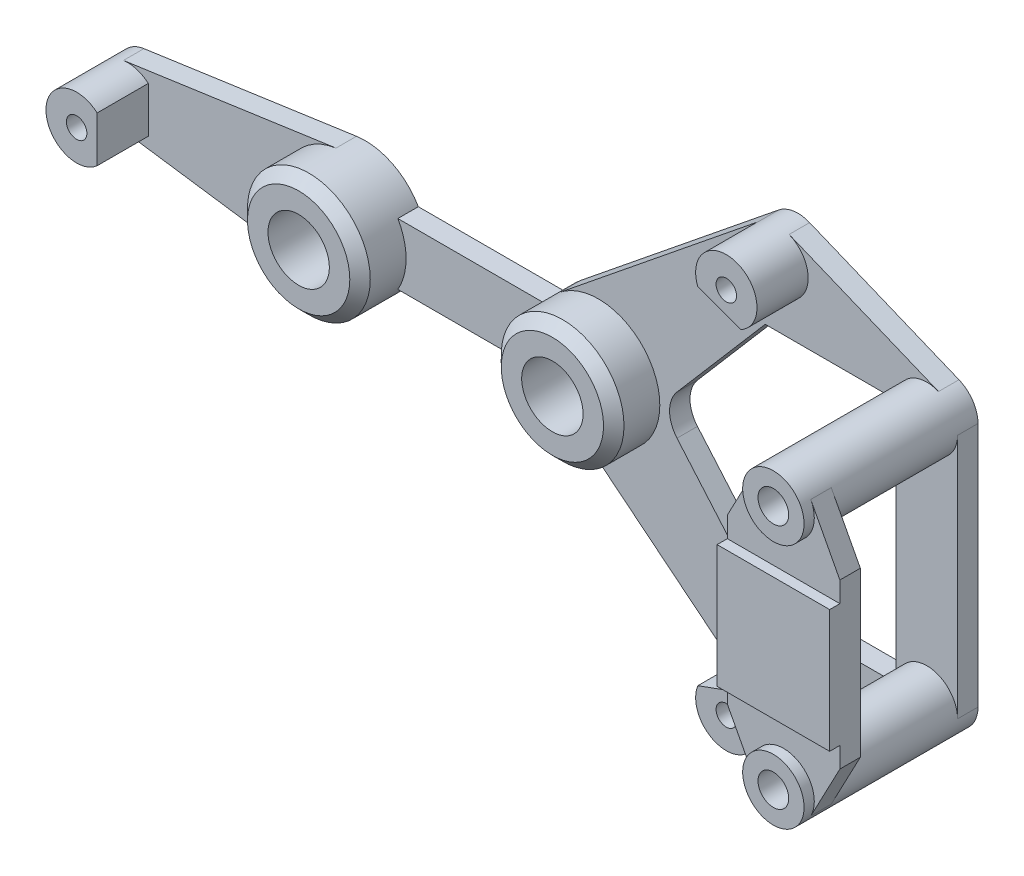
from build123d import *
from build123d.topology import SkipClean

# Parameters (mm, degrees)
BOSS_EXTRUDE1_DEPTH = 2
BOSS_EXTRUDE2_START = 4.5
SKETCH2_R           = 6
SKETCH2_R_2         = 3
BOSS_EXTRUDE2_DEPTH = 4.5
CHAMFER1_SIZE       = 1
BOSS_EXTRUDE3_START = 5
SKETCH3_R           = 1
BOSS_EXTRUDE3_DEPTH = 5
BOSS_EXTRUDE4_START = 15
SKETCH4_R           = 3
SKETCH4_R_2         = 1.5
BOSS_EXTRUDE4_DEPTH = 15
SKETCH5_R           = 1.5
BOSS_EXTRUDE5_DEPTH = 3
CUT_EXTRUDE1_DEPTH  = 1


with BuildPart() as part:
    # Sketch1 → Boss-Extrude1 (new body)
    with BuildSketch(Plane.XY):
        with BuildLine():
            Line((-5.196152423, 3), (-19.603847577, 3))
            ThreePointArc((-19.603847577, 3), (-22.176137566, 5.39586378), (-25.649056604, 5.939621443))
            Line((-25.649056604, 5.939621443), (-46.424528302, 2.969810721))
            ThreePointArc((-46.424528302, 2.969810721), (-49, 0), (-46.424528302, -2.969810721))
            Line((-46.424528302, -2.969810721), (-25.649056604, -5.939621443))
            ThreePointArc((-25.649056604, -5.939621443), (-22.176137566, -5.39586378), (-19.603847577, -3))
            Line((-19.603847577, -3), (-5.196152423, -3))
            ThreePointArc((-5.196152423, -3), (-4.560521825, -3.898928146), (-3.771341235, -4.666581756))
            Line((-3.771341235, -4.666581756), (15.614329382, -20.333290878))
            ThreePointArc((15.614329382, -20.333290878), (17.066851522, -20.968565714), (18.640337336, -20.774820852))
            Line((18.640337336, -20.774820852), (33.240337336, -14.774820852))
            ThreePointArc((33.240337336, -14.774820852), (34.592088683, -13.670177833), (35.1, -12))
            Line((35.1, -12), (35.1, 12))
            ThreePointArc((35.1, 12), (34.592088683, 13.670177833), (33.240337336, 14.774820852))
            Line((33.240337336, 14.774820852), (18.640337336, 20.774820852))
            ThreePointArc((18.640337336, 20.774820852), (17.066851522, 20.968565714), (15.614329382, 20.333290878))
            Line((15.614329382, 20.333290878), (-3.771341235, 4.666581756))
            ThreePointArc((-3.771341235, 4.666581756), (-4.560521825, 3.898928146), (-5.196152423, 3))
        make_face()
        with BuildLine():
            Line((7.677811186, 1.954226556), (16.302661255, 12))
            Line((16.302661255, 12), (29.1, 12))
            Line((29.1, 12), (29.1, -12))
            Line((29.1, -12), (16.302661255, -12))
            Line((16.302661255, -12), (7.677811186, -1.954226556))
            ThreePointArc((7.677811186, -1.954226556), (6.953991883, 0), (7.677811186, 1.954226556))
        make_face(mode=Mode.SUBTRACT)
    extrude(amount=-BOSS_EXTRUDE1_DEPTH)

    # Sketch2 → Boss-Extrude2 (add)
    # profile 1 of 2: a face of its own
    with BuildSketch(Plane.XY.offset(BOSS_EXTRUDE2_START)):
        with Locations((-24.8, 0)):
            Circle(SKETCH2_R)
        with Locations((-24.8, 0)):
            Circle(SKETCH2_R_2, mode=Mode.SUBTRACT)
    # profile 2 of 2: a face of its own
    with BuildSketch(Plane.XY.offset(BOSS_EXTRUDE2_START)):
        Circle(SKETCH2_R)
        Circle(SKETCH2_R_2, mode=Mode.SUBTRACT)
    extrude(amount=-BOSS_EXTRUDE2_DEPTH)

    # Chamfer1
    chamfer1_edges = [part.edges().sort_by_distance(p)[0] for p in [
        (-30.8, 0, 4.5),
        (-6, 0, 4.5),
    ]]
    chamfer(chamfer1_edges, length=CHAMFER1_SIZE)

    # Sketch3 → Boss-Extrude3 (add)
    # profile 1 of 3: a face of its own
    with SkipClean():  # the faces are left unmerged after this step: merging them gives an invalid solid
        with BuildSketch(Plane.XY.offset(BOSS_EXTRUDE3_START)):
            with BuildLine():
                Line((-44, -2.236067977), (-44, 2.236067977))
                ThreePointArc((-44, 2.236067977), (-49, 0), (-44, -2.236067977))
            make_face()
            with Locations((-46, 0)):
                Circle(SKETCH3_R, mode=Mode.SUBTRACT)
        # profile 2 of 3: a face of its own
        with BuildSketch(Plane.XY.offset(BOSS_EXTRUDE3_START)):
            with BuildLine():
                Line((14.714743135, -16.885395049), (18.917176291, -15.355834468))
                ThreePointArc((18.917176291, -15.355834468), (18.52606043, -20.819077862), (14.714743135, -16.885395049))
            make_face()
            with Locations((17.5, -18)):
                Circle(SKETCH3_R, mode=Mode.SUBTRACT)
        # profile 3 of 3: a face of its own
        with BuildSketch(Plane.XY.offset(BOSS_EXTRUDE3_START)):
            with BuildLine():
                Line((14.714743135, 16.885395049), (18.917176291, 15.355834468))
                ThreePointArc((18.917176291, 15.355834468), (18.52606043, 20.819077862), (14.714743135, 16.885395049))
            make_face()
            with Locations((17.5, 18)):
                Circle(SKETCH3_R, mode=Mode.SUBTRACT)
        extrude(amount=-BOSS_EXTRUDE3_DEPTH)

    # Sketch4 → Boss-Extrude4 (add)
    # profile 1 of 2: a face of its own
    with SkipClean():  # the faces are left unmerged after this step: merging them gives an invalid solid
        with BuildSketch(Plane.XY.offset(BOSS_EXTRUDE4_START)):
            with Locations((32.1, -12)):
                Circle(SKETCH4_R)
            with Locations((32.1, -12)):
                Circle(SKETCH4_R_2, mode=Mode.SUBTRACT)
        # profile 2 of 2: a face of its own
        with BuildSketch(Plane.XY.offset(BOSS_EXTRUDE4_START)):
            with Locations((32.1, 12)):
                Circle(SKETCH4_R)
            with Locations((32.1, 12)):
                Circle(SKETCH4_R_2, mode=Mode.SUBTRACT)
        extrude(amount=-BOSS_EXTRUDE4_DEPTH)

    # Sketch5 → Boss-Extrude5 (add)
    with BuildSketch(Plane.XY.offset(15)):
        with BuildLine():
            Line((29.446176569, -13.399007218), (26.6, -8))
            Line((26.6, -8), (26.6, 8))
            Line((26.6, 8), (29.446176569, 13.399007218))
            ThreePointArc((29.446176569, 13.399007218), (32.1, 15), (34.753823431, 13.399007218))
            Line((34.753823431, 13.399007218), (37.6, 8))
            Line((37.6, 8), (37.6, -8))
            Line((37.6, -8), (34.753823431, -13.399007218))
            ThreePointArc((34.753823431, -13.399007218), (32.1, -15), (29.446176569, -13.399007218))
        make_face()
        with Locations((32.1, -12)):
            Circle(SKETCH5_R, mode=Mode.SUBTRACT)
        with Locations((32.1, 12)):
            Circle(SKETCH5_R, mode=Mode.SUBTRACT)
    extrude(amount=-BOSS_EXTRUDE5_DEPTH)

    # Sketch6 → Cut-Extrude1 (cut)
    with BuildSketch(Plane.XY.offset(15)):
        with BuildLine():
            Line((29.446176569, 13.399007218), (26.6, 8))
            Line((26.6, 8), (26.6, 6))
            Line((26.6, 6), (37.6, 6))
            Line((37.6, 6), (37.6, 8))
            Line((37.6, 8), (34.753823431, 13.399007218))
            ThreePointArc((34.753823431, 13.399007218), (32.1, 9), (29.446176569, 13.399007218))
        make_face()
        with BuildLine():
            Line((26.6, -8), (29.446176569, -13.399007218))
            ThreePointArc((29.446176569, -13.399007218), (32.1, -9), (34.753823431, -13.399007218))
            Line((34.753823431, -13.399007218), (37.6, -8))
            Line((37.6, -8), (37.6, -6))
            Line((37.6, -6), (26.6, -6))
            Line((26.6, -6), (26.6, -8))
        make_face()
    extrude(amount=-CUT_EXTRUDE1_DEPTH, mode=Mode.SUBTRACT)


solid = part.part
